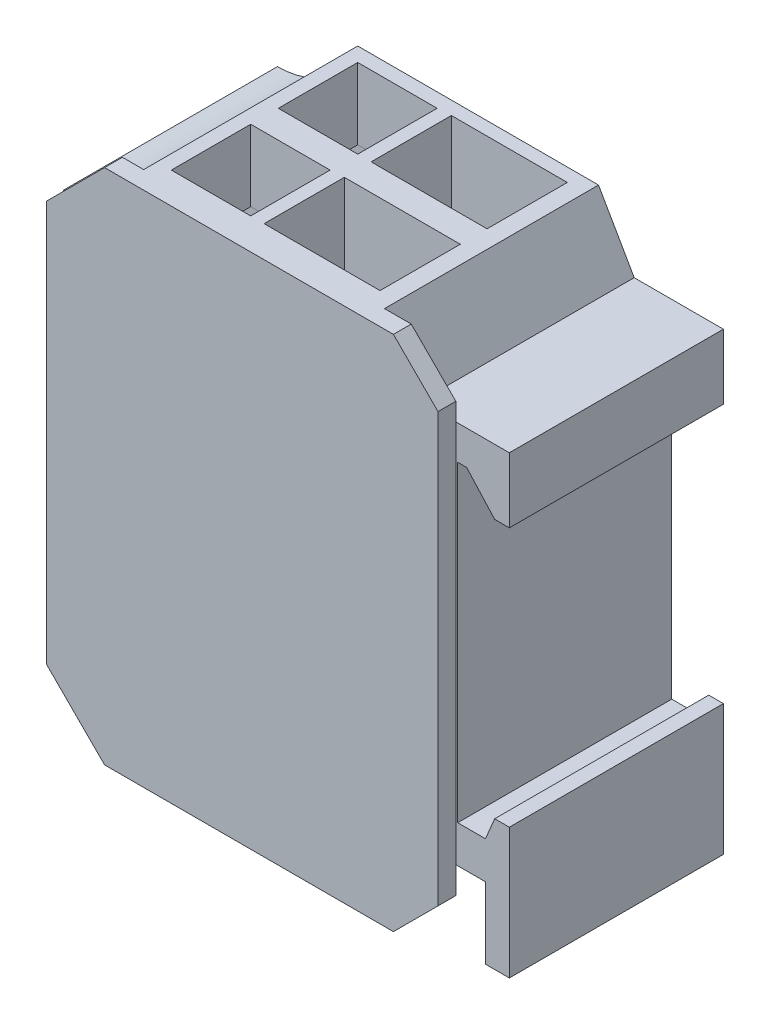
from build123d import *

# Parameters (mm, degrees)
EXTRUDE_2_DEPTH     = 24
SKETCH_4_W          = 8.901377932
SKETCH_4_H          = 8.901377932
SKETCH_4_W_2        = 13
SKETCH_4_H_2        = 9
CUT_EXTRUDE_3_DEPTH = 15
SKETCH_5_R          = 2
CUT_EXTRUDE_4_DEPTH = 2
SKETCH_6_W          = 8.901377932
SKETCH_6_H          = 8.901377932
SKETCH_6_W_2        = 13
SKETCH_6_H_2        = 9
CUT_EXTRUDE_5_DEPTH = 15
SKETCH_7_W          = 9
SKETCH_7_H          = 9
SKETCH_7_H_2        = 18.551992086
CUT_EXTRUDE_6_DEPTH = 15
EXTRUDE_3_DEPTH     = 2


with BuildPart() as part:
    # Эскиз1 → Вытянуть2 (new body)
    with BuildSketch(Plane.XY):
        with BuildLine():
            Line((53.716826077, 100.302263468), (49.716826077, 107.299731538))
            Line((49.716826077, 107.299731538), (43.716826077, 107.299731538))
            Line((43.716826077, 107.299731538), (22.716826077, 107.299731538))
            ThreePointArc((22.716826077, 107.299731538), (19.267726905, 102.594638084), (13.716826077, 100.799731538))
            Line((13.716826077, 100.799731538), (13.716826077, 88.799731538))
            Line((13.716826077, 88.799731538), (17.252144627, 84.799731538))
            Line((17.252144627, 84.799731538), (17.252144627, 71.799731538))
            Line((17.252144627, 71.799731538), (13.716826077, 67.799731538))
            Line((13.716826077, 67.799731538), (13.716826077, 55.799731538))
            ThreePointArc((13.716826077, 55.799731538), (19.267726905, 54.004824992), (22.716826077, 49.299731538))
            Line((22.716826077, 49.299731538), (49.716826077, 49.299731538))
            Line((49.716826077, 49.299731538), (49.716826077, 57.299731538))
            Line((49.716826077, 57.299731538), (61.039926278, 57.299731538))
            Line((61.039926278, 57.299731538), (61.039926278, 49.299731538))
            Line((61.039926278, 49.299731538), (63.716826077, 49.299731538))
            Line((63.716826077, 49.299731538), (63.716826077, 57.299731538))
            Line((63.716826077, 57.299731538), (63.716826077, 63.945130452))
            Line((63.716826077, 63.945130452), (62.075665924, 63.945130452))
            Line((62.075665924, 63.945130452), (61.039926278, 61.482439413))
            Line((61.039926278, 61.482439413), (57.925918002, 61.482439413))
            Line((57.925918002, 61.482439413), (57.925918002, 96.482439413))
            Line((57.925918002, 96.482439413), (58.925918002, 96.482439413))
            Line((58.925918002, 96.482439413), (62.075665924, 93.009879938))
            Line((62.075665924, 93.009879938), (63.716826077, 93.009879938))
            Line((63.716826077, 93.009879938), (63.716826077, 100.302263468))
            Line((63.716826077, 100.302263468), (53.716826077, 100.302263468))
        make_face()
    extrude(amount=EXTRUDE_2_DEPTH)

    # Эскиз4 → Вырез-Вытянуть3 (cut)
    with BuildSketch(Plane(origin=(0, 107.299731538, 0), x_dir=(-1, 0, 0), z_dir=(0, 1, 0))):
        with Locations((-28.766137111, 6.049311034)):
            Rectangle(SKETCH_4_W, SKETCH_4_H)
        with Locations((-28.766137111, 18.049311034)):
            Rectangle(SKETCH_4_W, SKETCH_4_H)
        with Locations((-41.216826077, 18)):
            Rectangle(SKETCH_4_W_2, SKETCH_4_H_2)
        with Locations((-41.216826077, 6)):
            Rectangle(SKETCH_4_W_2, SKETCH_4_H_2)
    extrude(amount=-CUT_EXTRUDE_3_DEPTH, mode=Mode.SUBTRACT)

    # Эскиз5 → Вырез-Вытянуть4 (cut)
    with BuildSketch(Plane(origin=(0, 92.299731538, 0), x_dir=(-1, 0, 0), z_dir=(0, 1, 0))):
        with Locations(Location((-41.216826077, 18, 0), (0, 0, 90))):
            Circle(SKETCH_5_R)
        with Locations(Location((-41.216826077, 6, 0), (0, 0, 90))):
            Circle(SKETCH_5_R)
    extrude(amount=-CUT_EXTRUDE_4_DEPTH, mode=Mode.SUBTRACT)

    # Эскиз6 → Вырез-Вытянуть5 (cut)
    with BuildSketch(Plane.XZ.offset(-49.299731538)):
        with Locations((28.766137111, 6.049311034)):
            Rectangle(SKETCH_6_W, SKETCH_6_H)
        with Locations((41.216826077, 6)):
            Rectangle(SKETCH_6_W_2, SKETCH_6_H_2)
        with Locations((41.216826077, 18)):
            Rectangle(SKETCH_6_W_2, SKETCH_6_H_2)
        with Locations((28.766137111, 18.049311034)):
            Rectangle(SKETCH_6_W, SKETCH_6_H)
    extrude(amount=-CUT_EXTRUDE_5_DEPTH, mode=Mode.SUBTRACT)

    # Эскиз7 → Вырез-Вытянуть6 (cut)
    with BuildSketch(Plane.ZY.offset(-13.716826077)):
        with Locations((18, 94.799731538)):
            Rectangle(SKETCH_7_W, SKETCH_7_H)
        with Locations((18, 61.799731538)):
            Rectangle(SKETCH_7_W, SKETCH_7_H)
        with Locations((6, 94.799731538)):
            Rectangle(SKETCH_7_W, SKETCH_7_H)
        with Locations((6, 61.799731538)):
            Rectangle(SKETCH_7_W, SKETCH_7_H)
        with Locations((6, 80.02885964)):
            Rectangle(SKETCH_7_W, SKETCH_7_H_2)
        with Locations((18, 80.02885964)):
            Rectangle(SKETCH_7_W, SKETCH_7_H_2)
    extrude(amount=-CUT_EXTRUDE_6_DEPTH, mode=Mode.SUBTRACT)

    # Эскиз8 → Вытянуть3 (add)
    with BuildSketch(Plane.XY.offset(24)):
        Polygon((20.331732254, 49.299731538), (52.716931495, 49.299731538), (57.716931495, 54.299731538), (57.716931495, 102.299731538), (52.716931495, 107.299731538), (20.331732254, 107.299731538), (13.831732254, 100.799731538), (13.831732254, 55.799731538), align=None)
    extrude(amount=EXTRUDE_3_DEPTH)


solid = part.part
